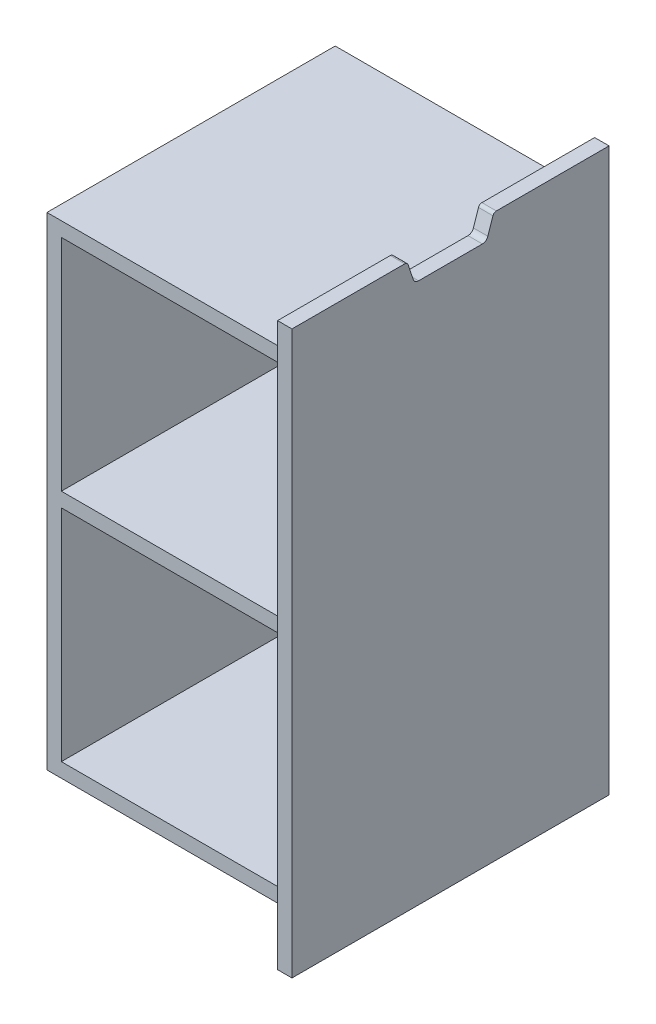
from build123d import *

# Parameters (mm, degrees)
SKETCH1_W                = 340
SKETCH1_H                = 400
BOSS_EXTRUDE1_DEPTH      = 20
SKETCH2_W                = 20
SKETCH2_H                = 400
BOSS_EXTRUDE2_DEPTH      = 630
SKETCH3_W                = 300
SKETCH3_H                = 400
BOSS_EXTRUDE3_DEPTH      = 10
BOSS_EXTRUDE4_DEPTH      = 20
BOSS_EXTRUDE4_DEPTH_BACK = 420
SKETCH8_W                = 20
SKETCH8_H                = 780
CUT_EXTRUDE4_DEPTH       = 20
FILLET1_R                = 5
SKETCH10_R               = 3
CUT_EXTRUDE5_DEPTH       = 13
SKETCH11_R               = 3
CUT_EXTRUDE6_DEPTH       = 13
MIRROR5_COPY_1_SKETCH_R  = 3
MIRROR5_COPY_1_DEPTH     = 13


with BuildPart() as part:
    # Sketch1 → Boss-Extrude1 (new body)
    with BuildSketch(Plane(origin=(0, 0, 0), x_dir=(1, 0, 0), z_dir=(0, 1, 0))):
        Rectangle(SKETCH1_W, SKETCH1_H)
    boss_extrude1 = extrude(amount=BOSS_EXTRUDE1_DEPTH)

    # Sketch2 → Boss-Extrude2 (add)
    with BuildSketch(Plane(origin=(0, 20, 0), x_dir=(1, 0, 0), z_dir=(0, 1, 0))):
        with Locations((-160, 0)):
            Rectangle(SKETCH2_W, SKETCH2_H)
    boss_extrude2 = extrude(amount=BOSS_EXTRUDE2_DEPTH)

    # Sketch3 → Boss-Extrude3 (add, symmetric)
    with BuildSketch(Plane(origin=(0, 335, 0), x_dir=(1, 0, 0), z_dir=(0, 1, 0))):
        Rectangle(SKETCH3_W, SKETCH3_H)
    extrude(amount=BOSS_EXTRUDE3_DEPTH, both=True)

    # Mirror1: Boss-Extrude1 across plane
    add(boss_extrude1.mirror(Plane.ZX.offset(335)))

    # Mirror2: Boss-Extrude2 across plane
    add(boss_extrude2.mirror(Plane(origin=(0, 0, 0), x_dir=(0, 0, 1), z_dir=(1, 0, 0))))

    # Sketch8 → Boss-Extrude4 (add, two sides: drawn at the far end of the back side and taken through both)
    with BuildSketch(Plane.XY.offset(200).offset(-BOSS_EXTRUDE4_DEPTH_BACK)):
        with Locations((180, 330)):
            Rectangle(SKETCH8_W, SKETCH8_H)
    extrude(amount=BOSS_EXTRUDE4_DEPTH + BOSS_EXTRUDE4_DEPTH_BACK)

    # Sketch9 → Cut-Extrude4 (cut)
    with BuildSketch(Plane(origin=(190, 0, 0), x_dir=(0, 0, -1), z_dir=(1, 0, 0))):
        with BuildLine():
            Line((-60, 720), (-51.823392624, 695.470177872))
            ThreePointArc((-51.823392624, 695.470177872), (-48.911608517, 691.510062519), (-44.23392624, 690))
            Line((-44.23392624, 690), (44.23392624, 690))
            ThreePointArc((44.23392624, 690), (48.911608517, 691.510062519), (51.823392624, 695.470177872))
            Line((51.823392624, 695.470177872), (60, 720))
            Line((60, 720), (-60, 720))
        make_face()
    extrude(amount=-CUT_EXTRUDE4_DEPTH, mode=Mode.SUBTRACT)

    # Fillet1
    fillet1_edges = [part.edges().sort_by_distance(p)[0] for p in [
        (180, 720, 60),
        (180, 720, -60),
    ]]
    fillet(fillet1_edges, radius=FILLET1_R)

    # Sketch10 → Cut-Extrude5 (cut)
    with BuildSketch(Plane.ZY.offset(170)):
        with Locations((174, 628.5)):
            Circle(SKETCH10_R)
        with Locations((142.5, 628.5)):
            Circle(SKETCH10_R)
        with Locations((111, 628.5)):
            Circle(SKETCH10_R)
    cut_extrude5 = extrude(amount=-CUT_EXTRUDE5_DEPTH, mode=Mode.SUBTRACT)

    # Mirror3: Cut-Extrude5 across plane
    add(cut_extrude5.mirror(Plane.XY), mode=Mode.SUBTRACT)

    # Sketch11 → Cut-Extrude6 (cut)
    with BuildSketch(Plane.XZ):
        with Locations(Location((-124, -140, 0), (0, 0, 270))):
            Circle(SKETCH11_R)
        with Locations(Location((-76, -140, 0), (0, 0, 270))):
            Circle(SKETCH11_R)
    cut_extrude6 = extrude(amount=-CUT_EXTRUDE6_DEPTH, mode=Mode.SUBTRACT)

    # Mirror4: Cut-Extrude6 across plane
    add(cut_extrude6.mirror(Plane(origin=(0, 0, 0), x_dir=(0, 0, 1), z_dir=(1, 0, 0))), mode=Mode.SUBTRACT)

    # Mirror5: Cut-Extrude6 across plane
    add(cut_extrude6.mirror(Plane.XY), mode=Mode.SUBTRACT)

    # Mirror5 copy 1 sketch → Mirror5 copy 1 (cut)
    with BuildSketch(Plane(origin=(0, 0, 0), x_dir=(-1, 0, 0), z_dir=(0, -1, 0))):
        with Locations(Location((-124, -140, 0), (0, 0, 270))):
            Circle(MIRROR5_COPY_1_SKETCH_R)
        with Locations(Location((-76, -140, 0), (0, 0, 270))):
            Circle(MIRROR5_COPY_1_SKETCH_R)
    extrude(amount=-MIRROR5_COPY_1_DEPTH, mode=Mode.SUBTRACT)


solid = part.part
